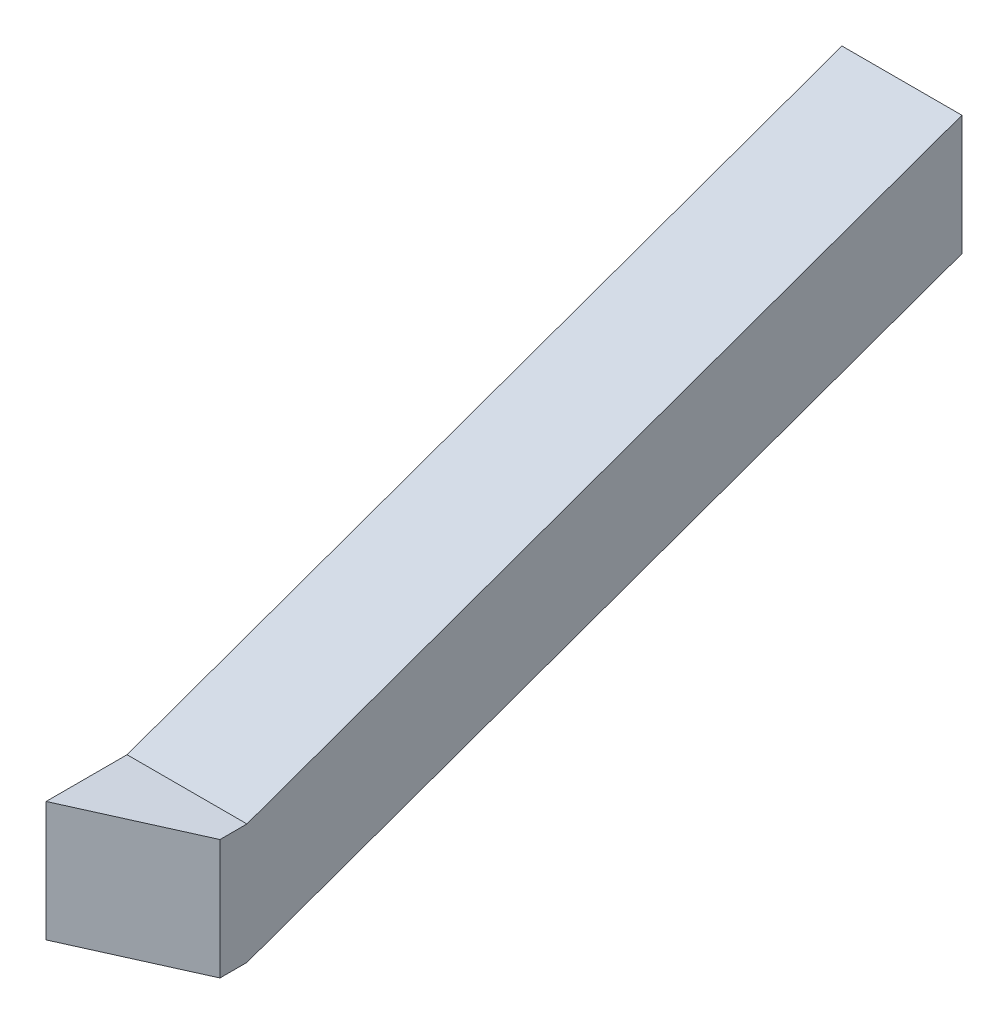
from build123d import *

# Parameters (mm, degrees)
CROQUIS1_W              = 88.9
CROQUIS1_H              = 88.9
SALIENTE_EXTRUIR1_DEPTH = 60
CROQUIS2_W              = 88.9
CROQUIS2_H              = 88.9
CORTAR_EXTRUIR1_DEPTH   = 100


with BuildPart() as part:
    # Croquis1 → Saliente-Extruir1 (new body)
    with BuildSketch(Plane.XY):
        with Locations((44.45, 44.45)):
            Rectangle(CROQUIS1_W, CROQUIS1_H)
    extrude(amount=-SALIENTE_EXTRUIR1_DEPTH)

    # Barrer1: sweep along a curve in space
    with BuildLine() as barrer1_path:
        Line((44.45, 234.45, -590), (44.45, 44.45, -60))
    # Croquis2 → Barrer1 (sweep)
    with BuildSketch(Plane(origin=(0, 0, -60), x_dir=(-1, 0, 0), z_dir=(0, 0, -1))):
        with Locations((-44.45, 44.45)):
            Rectangle(CROQUIS2_W, CROQUIS2_H)
    sweep(path=barrer1_path.line)

    # Croquis3 → Cortar-Extruir1 (cut)
    with BuildSketch(Plane(origin=(0, 88.9, 0), x_dir=(1, 0, 0), z_dir=(0, 1, 0))):
        Polygon((0, 0), (88.9, 40), (88.9, 0), align=None)
    extrude(amount=-CORTAR_EXTRUIR1_DEPTH, mode=Mode.SUBTRACT)


solid = part.part
